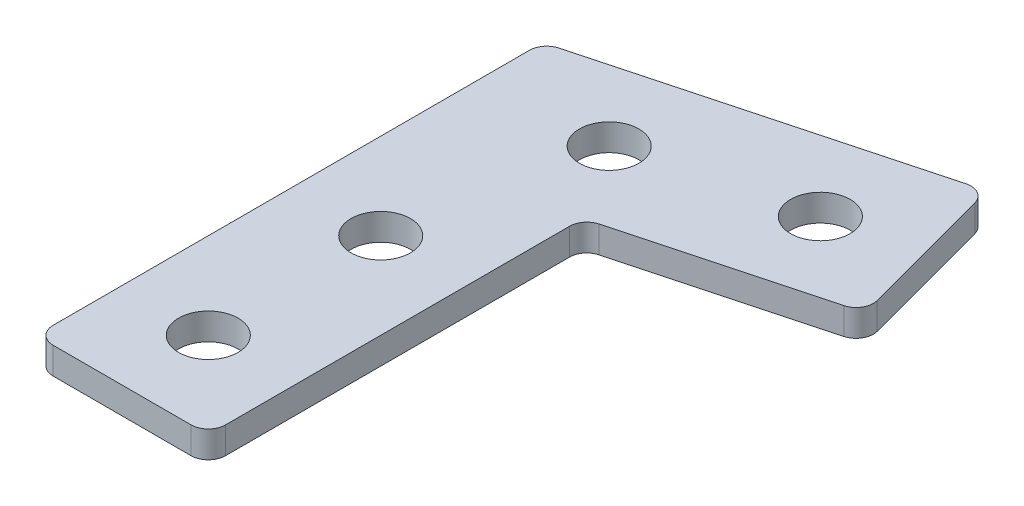
from build123d import *

# Parameters (mm, degrees)
SKETCH2_R           = 1.725
SKETCH2_W           = 10
SKETCH2_H           = 20
BOSS_EXTRUDE1_DEPTH = 1.55
FILLET1_R           = 1


with BuildPart() as part:
    # Sketch2 → Boss-Extrude1 (new body)
    # profile 1 of 4: a face of its own
    with BuildSketch(Plane(origin=(0, 0, 0), x_dir=(1, 0, 0), z_dir=(0, 1, 0))):
        Polygon((17.906706977, 15.176380902), (-1.411809549, 10), (-4, 19.659258263), (15.318516526, 24.835639165), align=None)
        with Locations(Location((11.78298262, 18.711914808, 0), (0, 0, 90))):
            Circle(SKETCH2_R, mode=Mode.SUBTRACT)
        with Locations(Location((2.123724357, 16.123724357, 0), (0, 0, 90))):
            Circle(SKETCH2_R, mode=Mode.SUBTRACT)
    # profile 2 of 4: a face of its own
    with BuildSketch(Plane(origin=(0, 0, 0), x_dir=(1, 0, 0), z_dir=(0, 1, 0))):
        Polygon((-1.411809549, 10), (-4, 19.659258263), (-5, 19.39130907), (-5, 10), align=None)
    # profile 3 of 4: a face of its own
    with BuildSketch(Plane(origin=(0, 0, 0), x_dir=(1, 0, 0), z_dir=(0, 1, 0))):
        Rectangle(SKETCH2_W, SKETCH2_H)
        with Locations(Location((0, 5, 0), (0, 0, 90))):
            Circle(SKETCH2_R, mode=Mode.SUBTRACT)
        with Locations(Location((0, -5, 0), (0, 0, 90))):
            Circle(SKETCH2_R, mode=Mode.SUBTRACT)
    # profile 4 of 4: a face of its own
    with BuildSketch(Plane(origin=(0, 0, 0), x_dir=(1, 0, 0), z_dir=(0, 1, 0))):
        Polygon((5, 11.718039191), (-1.411809549, 10), (5, 10), align=None)
    extrude(amount=BOSS_EXTRUDE1_DEPTH)

    # Fillet1
    fillet1_edges = [part.edges().sort_by_distance(p)[0] for p in [
        (-5, 0.775, 10),
        (-5, 0.775, -19.39130907),
        (15.318516526, 0.775, -24.835639165),
        (17.906706977, 0.775, -15.176380902),
        (5, 0.775, -11.718039191),
        (5, 0.775, 10),
    ]]
    fillet(fillet1_edges, radius=FILLET1_R)


solid = part.part
